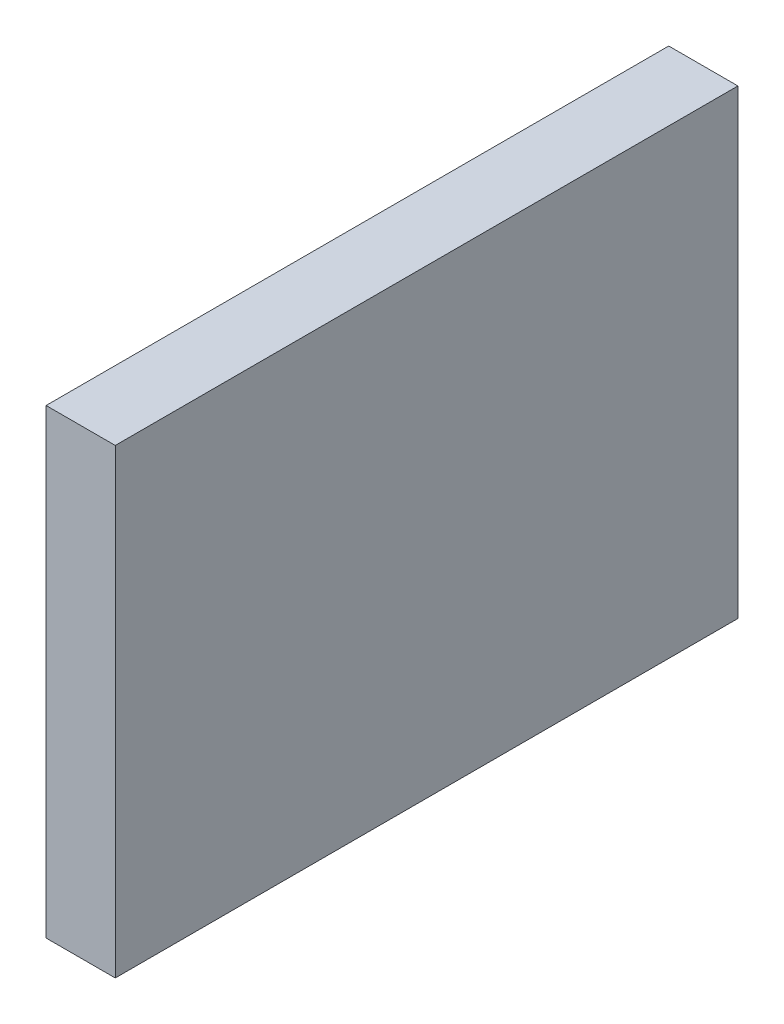
from build123d import *

# Parameters (mm, degrees)
SKETCH1_W           = 19.05
SKETCH1_H           = 127
BOSS_EXTRUDE1_DEPTH = 171.45


with BuildPart() as part:
    # Sketch1 → Boss-Extrude1 (new body)
    with BuildSketch(Plane.XY):
        with Locations((-1.180088496, -48.032411504)):
            Rectangle(SKETCH1_W, SKETCH1_H)
    extrude(amount=BOSS_EXTRUDE1_DEPTH)


solid = part.part
